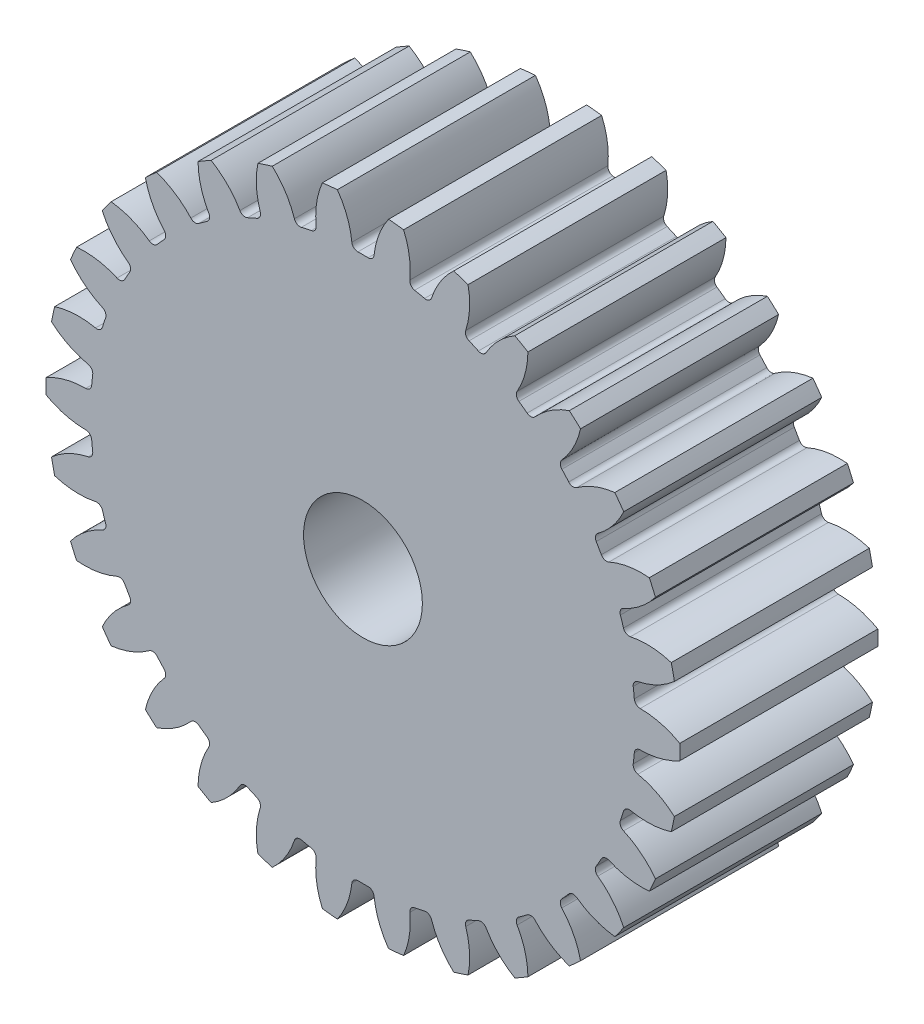
from build123d import *

# Parameters (mm, degrees)
SKETCH1_R                = 32
BOSS_EXTRUDE1_DEPTH      = 10
SKETCH2_R                = 6
CUT_EXTRUDE1_DEPTH       = 47.346520905
FILLET1_R                = 0.6
CIRPATTERN1_COUNT        = 30
FILLET1_OF_CIRPATTERN1_R = 0.6


with BuildPart() as part:
    # Sketch1 → Boss-Extrude1 (new, symmetric)
    with BuildSketch(Plane.XY):
        Circle(SKETCH1_R)
    extrude(amount=BOSS_EXTRUDE1_DEPTH, both=True)

    # Sketch2 → Cut-Extrude1 (cut, symmetric)
    with BuildSketch(Plane.XY):
        Circle(SKETCH2_R)
        with BuildLine():
            ThreePointArc((-3.356755572, 32.828831719), (-1.729097415, 30.362249055), (-1.082239285, 27.478696442))
            ThreePointArc((-1.082239285, 27.478696442), (0, 27.5), (1.082239285, 27.478696442))
            ThreePointArc((1.082239285, 27.478696442), (1.729097415, 30.362249055), (3.356755572, 32.828831719))
            ThreePointArc((3.356755572, 32.828831719), (0, 33), (-3.356755572, 32.828831719))
        make_face()
    cut_extrude1 = extrude(amount=CUT_EXTRUDE1_DEPTH, both=True, mode=Mode.SUBTRACT)

    # Fillet1
    fillet1_edges = [part.edges().sort_by_distance(p)[0] for p in [
        (-1.082239285, 27.478696442, 0),
        (1.082239285, 27.478696442, 0),
    ]]
    fillet(fillet1_edges, radius=FILLET1_R)

    # CirPattern1: Cut-Extrude1 ×30 about axis
    cirpattern1_axis = Axis((0, 0, 0), (0, 0, 1))
    for i in range(1, CIRPATTERN1_COUNT):
        add(cut_extrude1.rotate(cirpattern1_axis, i * 360 / CIRPATTERN1_COUNT), mode=Mode.SUBTRACT)

    # Fillet1 of CirPattern1
    fillet1_of_cirpattern1_edges = [part.edges().sort_by_distance(p)[0] for p in [
        (-6.771731999, 26.653210796, 0),
        (-4.654552478, 27.103231195, 0),
        (-12.16526753, 24.662851942, 0),
        (-10.187917963, 25.54322469, 0),
        (-17.027122495, 21.594608113, 0),
        (-15.276022547, 22.866856696, 0),
        (-21.144810501, 17.582576287, 0),
        (-19.696491642, 19.191097337, 0),
        (-24.338368824, 12.802101507, 0),
        (-23.256129539, 14.676594935, 0),
        (-26.468223641, 7.462113459, 0),
        (-25.799362979, 9.520654908, 0),
        (-27.441290077, 1.795995246, 0),
        (-27.215040458, 3.948616577, 0),
        (-27.215040458, -3.948616577, 0),
        (-27.441290077, -1.795995246, 0),
        (-25.799362979, -9.520654908, 0),
        (-26.468223641, -7.462113459, 0),
        (-23.256129539, -14.676594935, 0),
        (-24.338368824, -12.802101507, 0),
        (-19.696491642, -19.191097337, 0),
        (-21.144810501, -17.582576287, 0),
        (-15.276022547, -22.866856696, 0),
        (-17.027122495, -21.594608113, 0),
        (-10.187917963, -25.54322469, 0),
        (-12.16526753, -24.662851942, 0),
        (-4.654552478, -27.103231195, 0),
        (-6.771731999, -26.653210796, 0),
        (1.082239285, -27.478696442, 0),
        (-1.082239285, -27.478696442, 0),
        (6.771731999, -26.653210796, 0),
        (4.654552478, -27.103231195, 0),
        (12.16526753, -24.662851942, 0),
        (10.187917963, -25.54322469, 0),
        (17.027122495, -21.594608113, 0),
        (15.276022547, -22.866856696, 0),
        (21.144810501, -17.582576287, 0),
        (19.696491642, -19.191097337, 0),
        (24.338368824, -12.802101507, 0),
        (23.256129539, -14.676594935, 0),
        (26.468223641, -7.462113459, 0),
        (25.799362979, -9.520654908, 0),
        (27.441290077, -1.795995246, 0),
        (27.215040458, -3.948616577, 0),
        (27.215040458, 3.948616577, 0),
        (27.441290077, 1.795995246, 0),
        (25.799362979, 9.520654908, 0),
        (26.468223641, 7.462113459, 0),
        (23.256129539, 14.676594935, 0),
        (24.338368824, 12.802101507, 0),
        (19.696491642, 19.191097337, 0),
        (21.144810501, 17.582576287, 0),
        (15.276022547, 22.866856696, 0),
        (17.027122495, 21.594608113, 0),
        (10.187917963, 25.54322469, 0),
        (12.16526753, 24.662851942, 0),
        (4.654552478, 27.103231195, 0),
        (6.771731999, 26.653210796, 0),
    ]]
    fillet(fillet1_of_cirpattern1_edges, radius=FILLET1_OF_CIRPATTERN1_R)


solid = part.part
